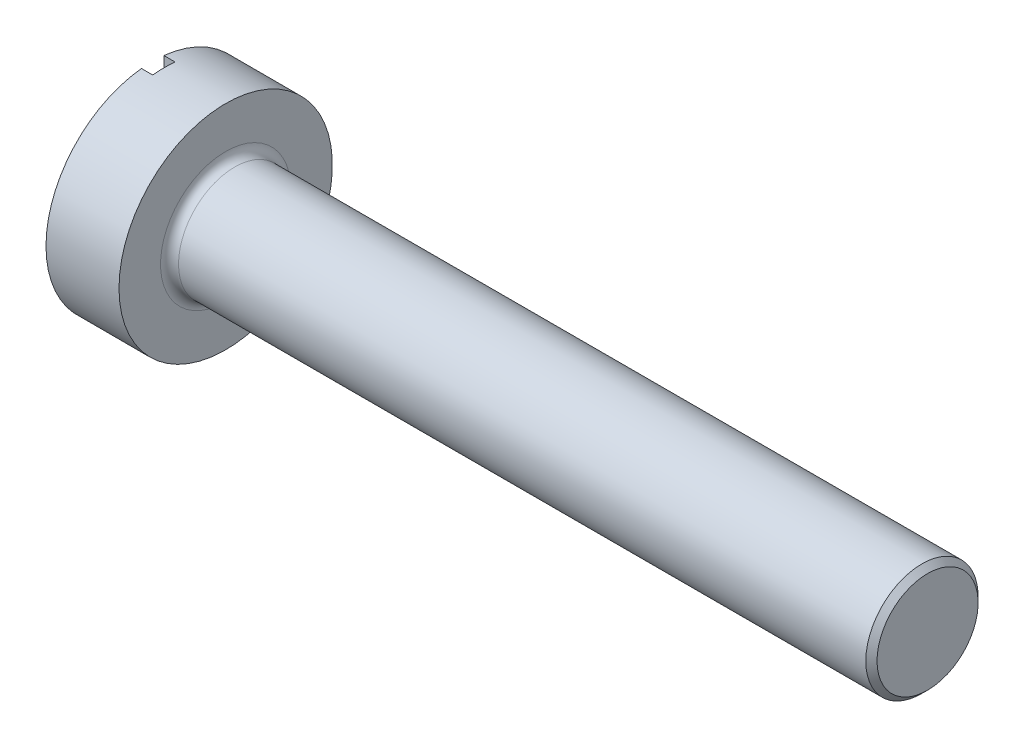
from build123d import *

# Parameters (mm, degrees)
CHAMFER1_SIZE       = 0.1
FILLET1_R           = 0.16
EXTRUDE1_DEPTH      = 15.059160715
EXTRUDE1_DEPTH_BACK = 15.059160715
SKETCH2_W           = 0.2
SKETCH2_H           = 0.2


with BuildPart() as part:
    # Sketch1 → Revolve1 (revolve)
    with BuildSketch(Plane.XY, mode=Mode.PRIVATE) as revolve1_sk:
        Polygon((0, 1.9), (0, 0), (13.8, 0), (13.8, 1), (1.3, 1), (1.3, 1.9), align=None)
    revolve(revolve1_sk.sketch.rotate(Axis((0, 0, 0), (1, 0, 0)), 90), axis=Axis((0, 0, 0), (1, 0, 0)))

    # Chamfer1
    chamfer1_edges = [part.edges().sort_by_distance(p)[0] for p in [
        (13.8, 0, -1),
    ]]
    chamfer(chamfer1_edges, length=CHAMFER1_SIZE)

    # Fillet1
    fillet1_edges = [part.edges().sort_by_distance(p)[0] for p in [
        (1.3, 0, -1),
    ]]
    fillet(fillet1_edges, radius=FILLET1_R)

    # Sketch2 → Extrude1 (cut, two sides: drawn at the far end of the back side and taken through both)
    with BuildSketch(Plane(origin=(0, 0, 0), x_dir=(1, 0, 0), z_dir=(0, 1, 0)).offset(-EXTRUDE1_DEPTH_BACK)):
        with Locations((0.1, -0.1)):
            Rectangle(SKETCH2_W, SKETCH2_H)
        with Locations((0.1, 0.1)):
            Rectangle(SKETCH2_W, SKETCH2_H)
    extrude(amount=EXTRUDE1_DEPTH + EXTRUDE1_DEPTH_BACK, mode=Mode.SUBTRACT)


solid = part.part
